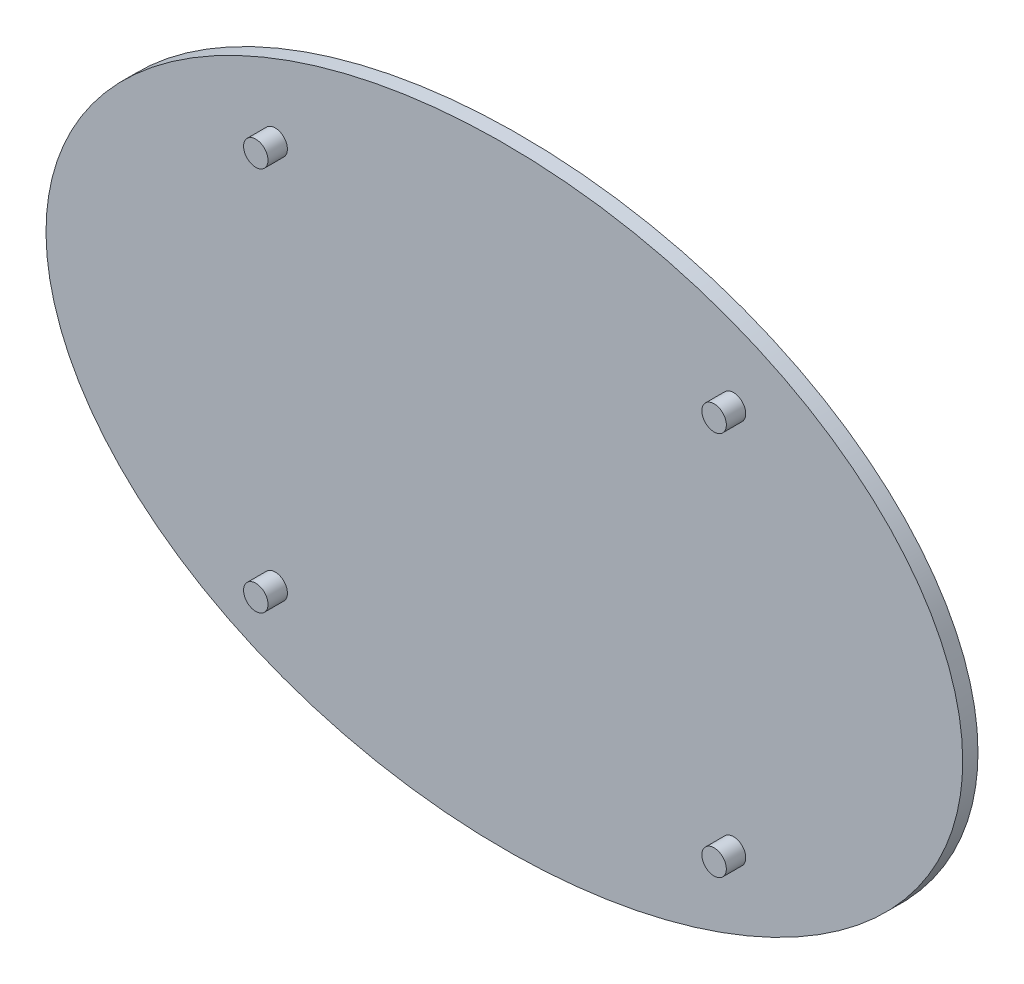
from build123d import *

# Parameters (mm, degrees)
SKETCH1_RX          = 150
SKETCH1_RY          = 100
BOSS_EXTRUDE1_DEPTH = 5
SKETCH2_R           = 4
BOSS_EXTRUDE2_DEPTH = 6.35


with BuildPart() as part:
    # Sketch1 → Boss-Extrude1 (new body)
    with BuildSketch(Plane.XY.offset(5)):
        with Locations(Location((0, 0), (0, 0, 0))):
            Ellipse(SKETCH1_RX, SKETCH1_RY)
    extrude(amount=-BOSS_EXTRUDE1_DEPTH)

    # Sketch2 → Boss-Extrude2 (add)
    with BuildSketch(Plane.XY.offset(5)):
        with Locations((-74.99305396, -62.926643919)):
            Circle(SKETCH2_R)
        with Locations(Location((-74.99305396, 62.926643919, 0), (0, 0, 180))):
            Circle(SKETCH2_R)
        with Locations((74.99305396, 62.926643919)):
            Circle(SKETCH2_R)
        with Locations(Location((74.99305396, -62.926643919, 0), (0, 0, 180))):
            Circle(SKETCH2_R)
    extrude(amount=BOSS_EXTRUDE2_DEPTH)


solid = part.part
